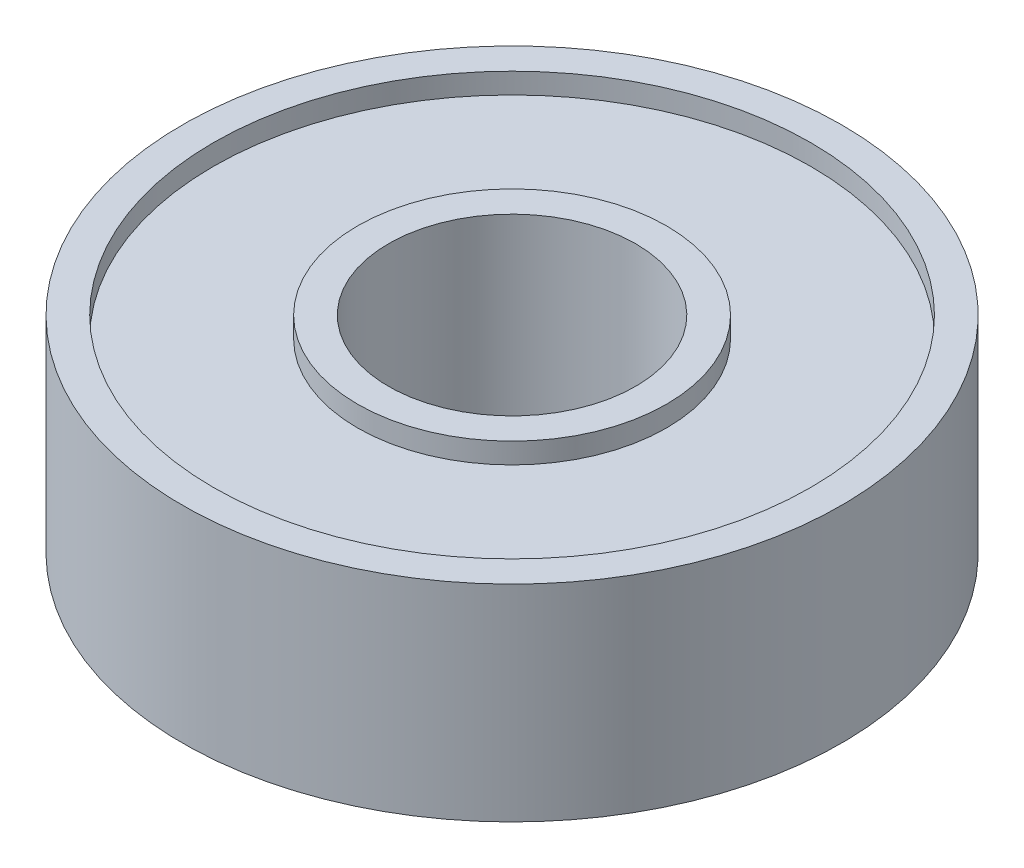
from build123d import *


with BuildPart() as part:
    # Croquis1 → Revolución1 (revolve)
    with BuildSketch(Plane.XY, mode=Mode.PRIVATE) as revoluci_n1_sk:
        Polygon((-6, 6.856705357), (-6, 16.856705357), (-7.5, 16.856705357), (-7.5, 15.856705357), (-14.5, 15.856705357), (-14.5, 16.856705357), (-16, 16.856705357), (-16, 6.856705357), (-14.5, 6.856705357), (-14.5, 7.856705357), (-7.5, 7.856705357), (-7.5, 6.856705357), align=None)
    revolve(revoluci_n1_sk.sketch.rotate(Axis((0, 0, 0), (0, 1, 0)), 270), axis=Axis((0, 0, 0), (0, 1, 0)))


solid = part.part
